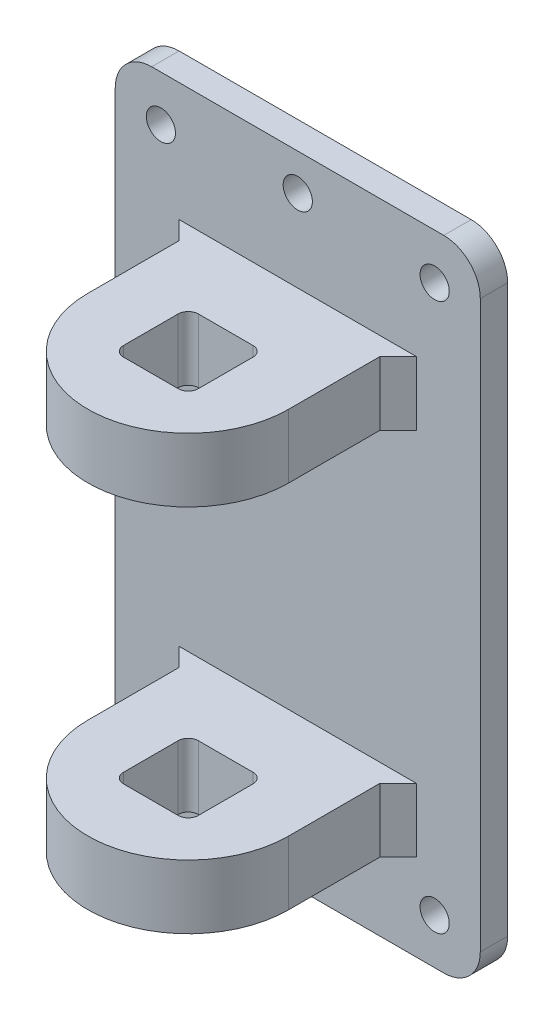
from build123d import *

# Parameters (mm, degrees)
SKETCH_1_W          = 40
SKETCH_1_H          = 70
EXTRUDE_1_DEPTH     = 3
SKETCH_2_W          = 22
SKETCH_2_H          = 61
EXTRUDE_2_DEPTH     = 3
SKETCH_3_W          = 22
SKETCH_3_H          = 7
EXTRUDE_3_DEPTH     = 12
SKETCH_4_R          = 11
EXTRUDE_4_DEPTH     = 7
SKETCH_7_R          = 1.6
CUT_EXTRUDE_2_DEPTH = 7
SKETCH_8_R          = 1.6
CUT_EXTRUDE_3_DEPTH = 7
FILLET_1_R          = 4
EXTRUDE_START       = -7
EXTRUDE_5_DEPTH     = 7
CUT_EXTRUDE_4_DEPTH = 66.76473219
CHAMFER_1_SIZE      = 2
CUT_EXTRUDE_5_DEPTH = 69.820418482


with BuildPart() as part:
    # 草图1 → 凸台-拉伸1 (new body)
    with BuildSketch(Plane.XY):
        Rectangle(SKETCH_1_W, SKETCH_1_H)
    extrude(amount=EXTRUDE_1_DEPTH)

    # 草图2 → 凸台-拉伸2 (add)
    with BuildSketch(Plane.XY.offset(3)):
        Rectangle(SKETCH_2_W, SKETCH_2_H)
    extrude(amount=-EXTRUDE_2_DEPTH)

    # 草图3 → 凸台-拉伸3 (add)
    with BuildSketch(Plane.XY.offset(3)):
        with Locations((0, -22)):
            Rectangle(SKETCH_3_W, SKETCH_3_H)
    extrude(amount=EXTRUDE_3_DEPTH)

    # 草图4 → 凸台-拉伸4 (add)
    with BuildSketch(Plane.XZ.offset(25.5)):
        with Locations((0, 15)):
            Circle(SKETCH_4_R)
    extrude(amount=-EXTRUDE_4_DEPTH)

    # 草图7 → 切除-拉伸2 (cut)
    with BuildSketch(Plane.XY.offset(3)):
        with Locations((-15, 30)):
            Circle(SKETCH_7_R)
        with Locations((15, 30)):
            Circle(SKETCH_7_R)
        with Locations((15, -30)):
            Circle(SKETCH_7_R)
        with Locations((-15, -30)):
            Circle(SKETCH_7_R)
    extrude(amount=-CUT_EXTRUDE_2_DEPTH, mode=Mode.SUBTRACT)

    # 草图8 → 切除-拉伸3 (cut)
    with BuildSketch(Plane.XY.offset(3)):
        with Locations((0, 31)):
            Circle(SKETCH_8_R)
        with Locations((0, -31)):
            Circle(SKETCH_8_R)
    extrude(amount=-CUT_EXTRUDE_3_DEPTH, mode=Mode.SUBTRACT)

    # 圆角1
    fillet_1_edges = [part.edges().sort_by_distance(p)[0] for p in [
        (20, -35, 1.5),
        (-20, -35, 1.5),
        (-20, 35, 1.5),
        (20, 35, 1.5),
    ]]
    fillet(fillet_1_edges, radius=FILLET_1_R)

    # 草图9 → 凸台-拉伸5 (add)
    with BuildSketch(Plane(origin=(0, 22, 0), x_dir=(1, 0, 0), z_dir=(0, 1, 0)).offset(EXTRUDE_START)):
        with BuildLine():
            Line((-11, -3), (-11, -15))
            ThreePointArc((-11, -15), (0, -26), (11, -15))
            Line((11, -15), (11, -3))
            Line((11, -3), (-11, -3))
        make_face()
    extrude(amount=EXTRUDE_5_DEPTH)

    # 草图10 → 切除-拉伸4 (cut, through all)
    with BuildSketch(Plane(origin=(0, 22, 0), x_dir=(1, 0, 0), z_dir=(0, 1, 0))):
        with BuildLine():
            Line((-3, -19), (3, -19))
            ThreePointArc((3, -19), (3.707106781, -18.707106781), (4, -18))
            Line((4, -18), (4, -12))
            ThreePointArc((4, -12), (3.707106781, -11.292893219), (3, -11))
            Line((3, -11), (-3, -11))
            ThreePointArc((-3, -11), (-3.707106781, -11.292893219), (-4, -12))
            Line((-4, -12), (-4, -18))
            ThreePointArc((-4, -18), (-3.707106781, -18.707106781), (-3, -19))
        make_face()
    extrude(amount=-CUT_EXTRUDE_4_DEPTH, mode=Mode.SUBTRACT)

    # 倒角1
    chamfer_1_edges = [part.edges().sort_by_distance(p)[0] for p in [
        (-11, 18.5, 3),
        (11, 18.5, 3),
        (11, -22, 3),
        (-11, -22, 3),
    ]]
    chamfer(chamfer_1_edges, length=CHAMFER_1_SIZE)

    # 草图11 → 切除-拉伸5 (cut, through all)
    with BuildSketch(Plane.XZ.offset(25.5)):
        with BuildLine():
            Line((-4.1, 18), (-4.1, 12))
            ThreePointArc((-4.1, 12), (-3.777817459, 11.222182541), (-3, 10.9))
            Line((-3, 10.9), (3, 10.9))
            ThreePointArc((3, 10.9), (3.777817459, 11.222182541), (4.1, 12))
            Line((4.1, 12), (4.1, 18))
            ThreePointArc((4.1, 18), (3.777817459, 18.777817459), (3, 19.1))
            Line((3, 19.1), (-3, 19.1))
            ThreePointArc((-3, 19.1), (-3.777817459, 18.777817459), (-4.1, 18))
        make_face()
    extrude(amount=-CUT_EXTRUDE_5_DEPTH, mode=Mode.SUBTRACT)


solid = part.part
